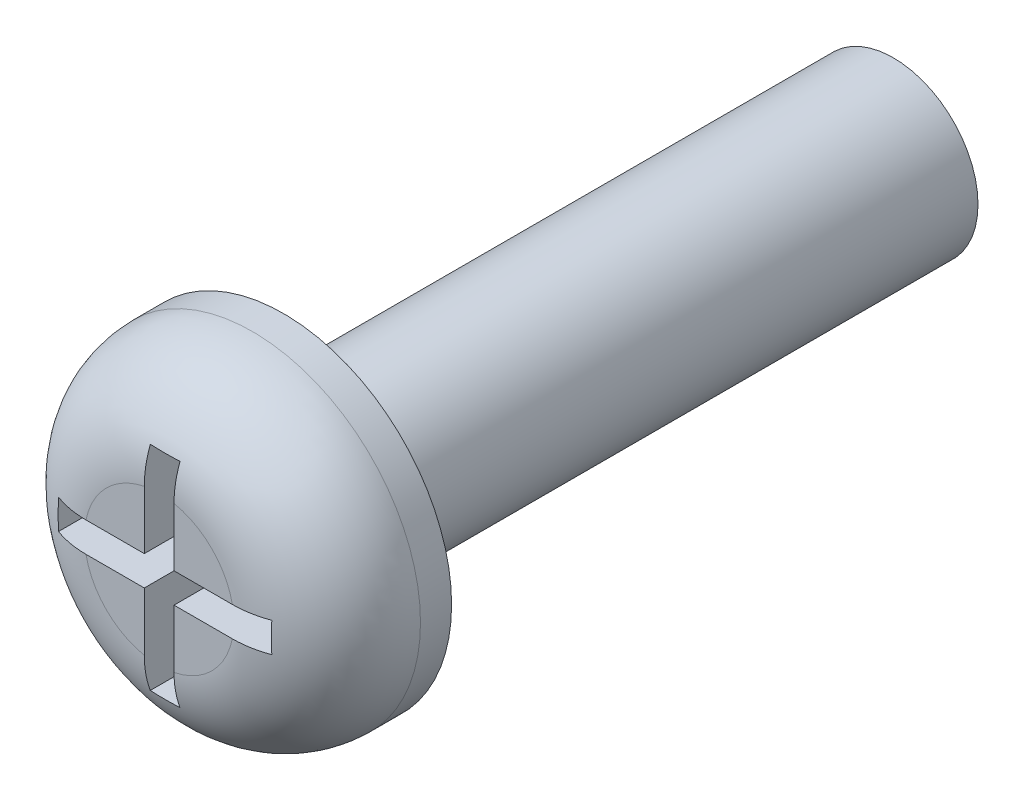
from build123d import *

# Parameters (mm, degrees)
SKETCH1_R           = 1.7272
BOSS_EXTRUDE1_DEPTH = 12.446
SKETCH2_R           = 3.429
BOSS_EXTRUDE2_DEPTH = 2.54
FILLET1_R           = 1.905
CUT_EXTRUDE1_DEPTH  = 1.905


with BuildPart() as part:
    # Sketch1 → Boss-Extrude1 (new body)
    with BuildSketch(Plane.XY):
        Circle(SKETCH1_R)
    extrude(amount=BOSS_EXTRUDE1_DEPTH)

    # Sketch2 → Boss-Extrude2 (add)
    with BuildSketch(Plane.XY.offset(12.446)):
        Circle(SKETCH2_R)
    extrude(amount=BOSS_EXTRUDE2_DEPTH)

    # Fillet1
    fillet1_edges = [part.edges().sort_by_distance(p)[0] for p in [
        (-3.429, 0, 14.986),
    ]]
    fillet(fillet1_edges, radius=FILLET1_R)

    # Sketch3 → Cut-Extrude1 (cut)
    with BuildSketch(Plane.XY.offset(14.986)):
        Polygon((-0.303567799, 0.303567799), (-0.303567799, 2.17637078), (0.303567799, 2.17637078), (0.303567799, 0.303567799), (2.17637078, 0.303567799), (2.17637078, -0.303567799), (0.303567799, -0.303567799), (0.303567799, -2.17637078), (-0.303567799, -2.17637078), (-0.303567799, -0.303567799), (-2.17637078, -0.303567799), (-2.17637078, 0.303567799), align=None)
    extrude(amount=-CUT_EXTRUDE1_DEPTH, mode=Mode.SUBTRACT)


solid = part.part
